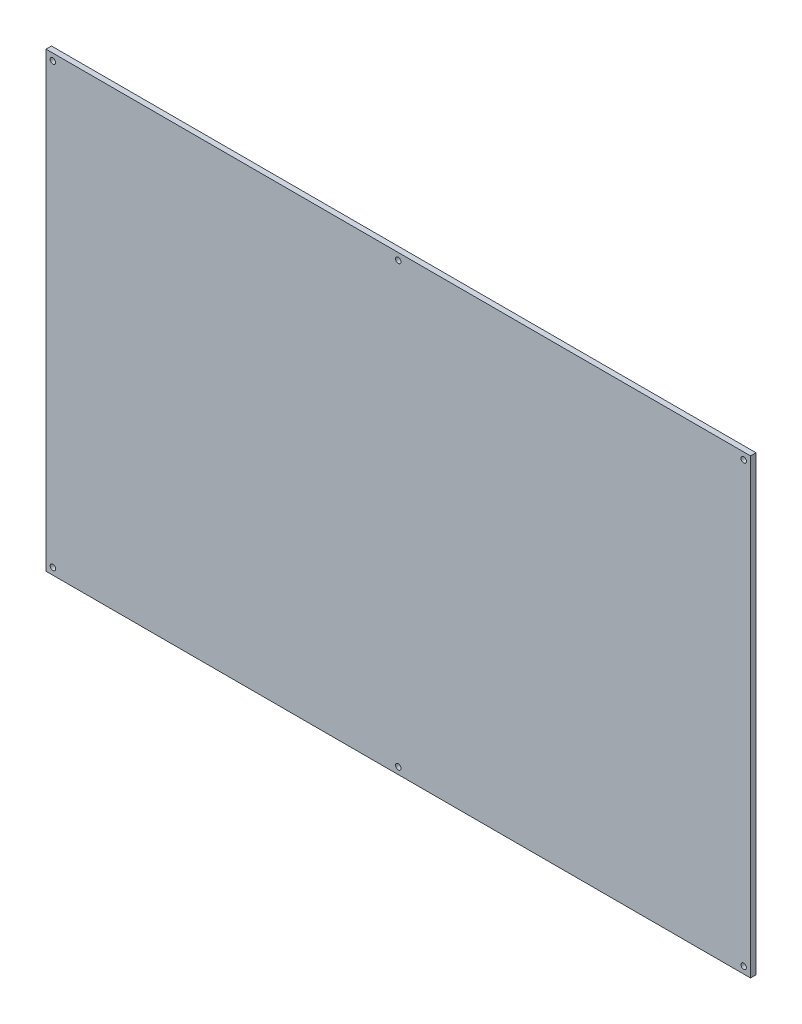
from build123d import *

# Parameters (mm, degrees)
ESQUISSE1_W        = 258.45
ESQUISSE1_H        = 165.9
ESQUISSE1_R        = 1
BOSS_EXTRU_1_DEPTH = 2


with BuildPart() as part:
    # Esquisse1 → Boss.-Extru.1 (new body)
    with BuildSketch(Plane.XY):
        with Locations((59.390498412, -49.118493909)):
            Rectangle(ESQUISSE1_W, ESQUISSE1_H)
        with Locations((-67.334501588, 31.331506091)):
            Circle(ESQUISSE1_R, mode=Mode.SUBTRACT)
        with Locations((59.385498412, 31.331506091)):
            Circle(ESQUISSE1_R, mode=Mode.SUBTRACT)
        with Locations((186.115498412, 31.331506091)):
            Circle(ESQUISSE1_R, mode=Mode.SUBTRACT)
        with Locations((-67.334501588, -129.568493909)):
            Circle(ESQUISSE1_R, mode=Mode.SUBTRACT)
        with Locations((59.385498412, -129.568493909)):
            Circle(ESQUISSE1_R, mode=Mode.SUBTRACT)
        with Locations((186.115498412, -129.568493909)):
            Circle(ESQUISSE1_R, mode=Mode.SUBTRACT)
    extrude(amount=BOSS_EXTRU_1_DEPTH)


solid = part.part
